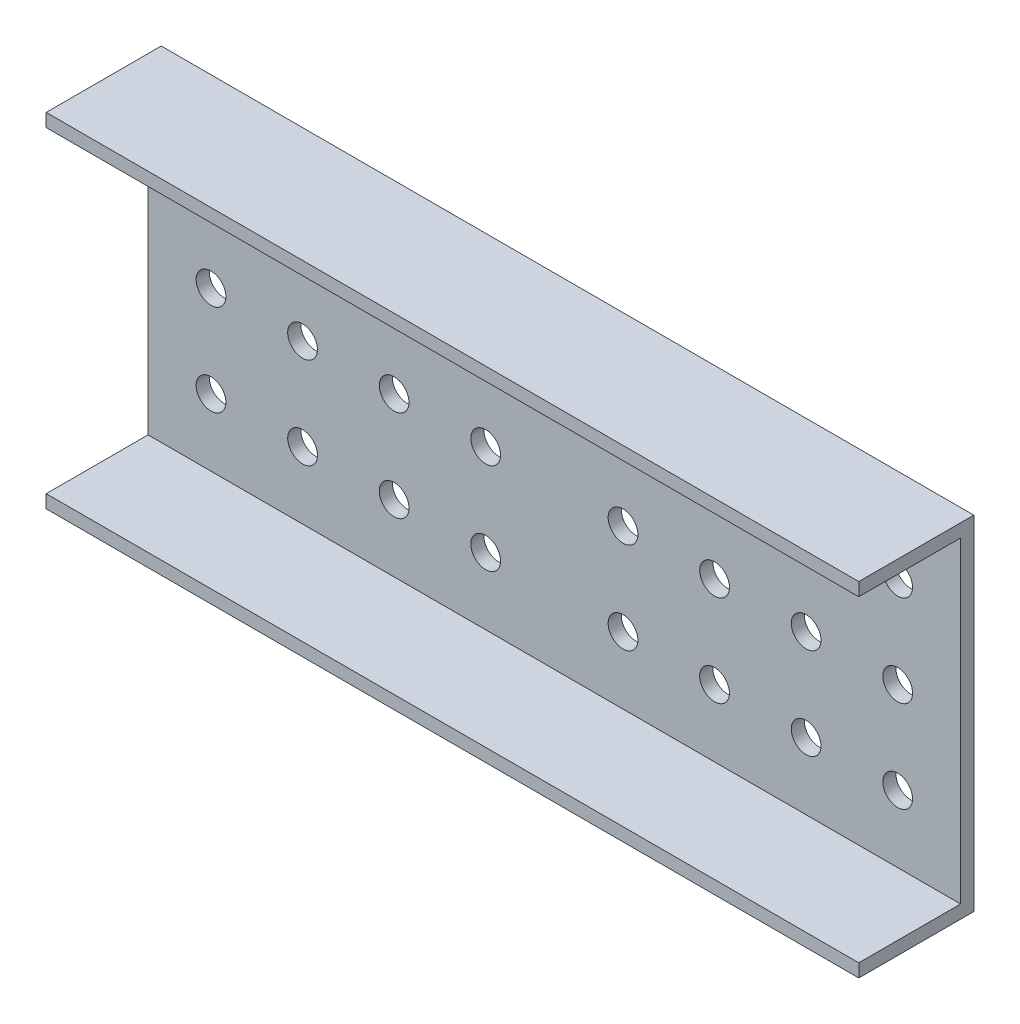
from build123d import *

# Parameters (mm, degrees)
SKETCH_1_W                  = 710
SKETCH_1_H                  = 300
EXTRUDE_1_DEPTH             = 11.5
SKETCH_2_R                  = 13
CUT_EXTRUDE_1_DEPTH         = 386.560954973
PATTERN_LINEAR_1_COUNT      = 4
PATTERN_LINEAR_1_PITCH      = 80
PATTERN_LINEAR_1_COUNT_DIR2 = 3
PATTERN_LINEAR_1_PITCH_DIR2 = 80
SKETCH_3_W                  = 710
SKETCH_3_H                  = 11.5
EXTRUDE_2_DEPTH             = 89


with BuildPart() as part:
    # 草图1 → 凸台-拉伸1 (new body)
    with BuildSketch(Plane.XY):
        Rectangle(SKETCH_1_W, SKETCH_1_H)
    extrude(amount=EXTRUDE_1_DEPTH)

    # 草图2 → 切除-拉伸1 (cut, through all)
    with BuildSketch(Plane.XY.offset(11.5)):
        with Locations((-300, 80)):
            Circle(SKETCH_2_R)
        with Locations((60, 80)):
            Circle(SKETCH_2_R)
    cut_extrude_1 = extrude(amount=-CUT_EXTRUDE_1_DEPTH, mode=Mode.SUBTRACT)

    # 阵列(线性)1: Cut-Extrude 1 4 × 3
    with Locations(*[(i * PATTERN_LINEAR_1_PITCH, -j * PATTERN_LINEAR_1_PITCH_DIR2, 0) for i in range(PATTERN_LINEAR_1_COUNT) for j in range(PATTERN_LINEAR_1_COUNT_DIR2) if (i, j) != (0, 0)]):
        add(cut_extrude_1, mode=Mode.SUBTRACT)

    # 草图3 → 凸台-拉伸2 (add)
    with BuildSketch(Plane.XY.offset(11.5)):
        with Locations((0, 144.25)):
            Rectangle(SKETCH_3_W, SKETCH_3_H)
    extrude_2 = extrude(amount=EXTRUDE_2_DEPTH)

    # 镜向1: 凸台-拉伸2 across plane
    add(extrude_2.mirror(Plane.ZX))


solid = part.part
